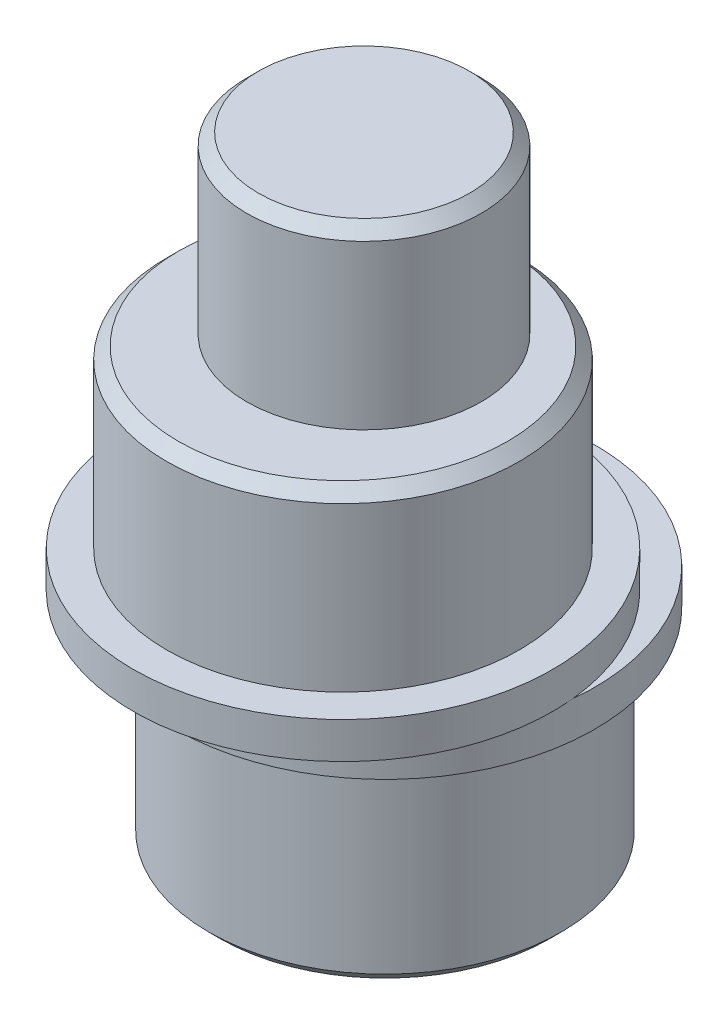
from build123d import *

# Parameters (mm, degrees)
SKETCH1_R               = 6.05
BOSS_EXTRUDE1_DEPTH     = 7
SKETCH2_R               = 7.2
BOSS_EXTRUDE2_DEPTH     = 1.25
SKETCH3_R               = 7.2
BOSS_EXTRUDE3_DEPTH     = 1.25
SKETCH4_R               = 6.05
BOSS_EXTRUDE4_DEPTH     = 6
CUT_EXTRUDE2_DEPTH      = 19.836570813
CUT_EXTRUDE2_DEPTH_BACK = 11
SKETCH6_R               = 4.025
BOSS_EXTRUDE5_DEPTH     = 6
CHAMFER1_SIZE           = 0.4
CHAMFER2_SIZE           = 0.4


with BuildPart() as part:
    # Sketch1 → Boss-Extrude1 (new body)
    with BuildSketch(Plane(origin=(0, 0, 0), x_dir=(1, 0, 0), z_dir=(0, 1, 0))):
        with Locations(Location((0, 0.72, 0), (0, 0, 270))):
            Circle(SKETCH1_R)
    extrude(amount=BOSS_EXTRUDE1_DEPTH)

    # Sketch2 → Boss-Extrude2 (add)
    with BuildSketch(Plane(origin=(0, 7, 0), x_dir=(1, 0, 0), z_dir=(0, 1, 0))):
        with Locations(Location((0, 0.72, 0), (0, 0, 270))):
            Circle(SKETCH2_R)
    extrude(amount=BOSS_EXTRUDE2_DEPTH)

    # Sketch3 → Boss-Extrude3 (add)
    with BuildSketch(Plane(origin=(0, 8.25, 0), x_dir=(1, 0, 0), z_dir=(0, 1, 0))):
        with Locations(Location((0, -0.72, 0), (0, 0, 174.260829523))):
            Circle(SKETCH3_R)
    extrude(amount=BOSS_EXTRUDE3_DEPTH)

    # Sketch4 → Boss-Extrude4 (add)
    with BuildSketch(Plane(origin=(0, 9.5, 0), x_dir=(1, 0, 0), z_dir=(0, 1, 0))):
        with Locations(Location((0, -0.72, 0), (0, 0, 270))):
            Circle(SKETCH4_R)
    extrude(amount=BOSS_EXTRUDE4_DEPTH)

    # Sketch5 → Cut-Extrude2 (cut, two sides: drawn at the far end of the back side and taken through both)
    with BuildSketch(Plane.XZ.offset(-CUT_EXTRUDE2_DEPTH_BACK)):
        with BuildLine():
            Line((1.506029548, 2.15), (-1.506029548, 2.15))
            ThreePointArc((-1.506029548, 2.15), (0, -2.625), (1.506029548, 2.15))
        make_face()
    extrude(amount=CUT_EXTRUDE2_DEPTH + CUT_EXTRUDE2_DEPTH_BACK, mode=Mode.SUBTRACT)

    # Sketch6 → Boss-Extrude5 (add)
    with BuildSketch(Plane(origin=(0, 15.5, 0), x_dir=(1, 0, 0), z_dir=(0, 1, 0))):
        with Locations(Location((0, 0, 0), (0, 0, 270))):
            Circle(SKETCH6_R)
    extrude(amount=BOSS_EXTRUDE5_DEPTH)

    # Chamfer1
    chamfer1_edges = [part.edges().sort_by_distance(p)[0] for p in [
        (0, 21.5, -4.025),
    ]]
    chamfer(chamfer1_edges, length=CHAMFER1_SIZE)

    # Chamfer2
    chamfer2_edges = [part.edges().sort_by_distance(p)[0] for p in [
        (0, 15.5, -5.33),
        (0, 0, -6.77),
    ]]
    chamfer(chamfer2_edges, length=CHAMFER2_SIZE)


solid = part.part
